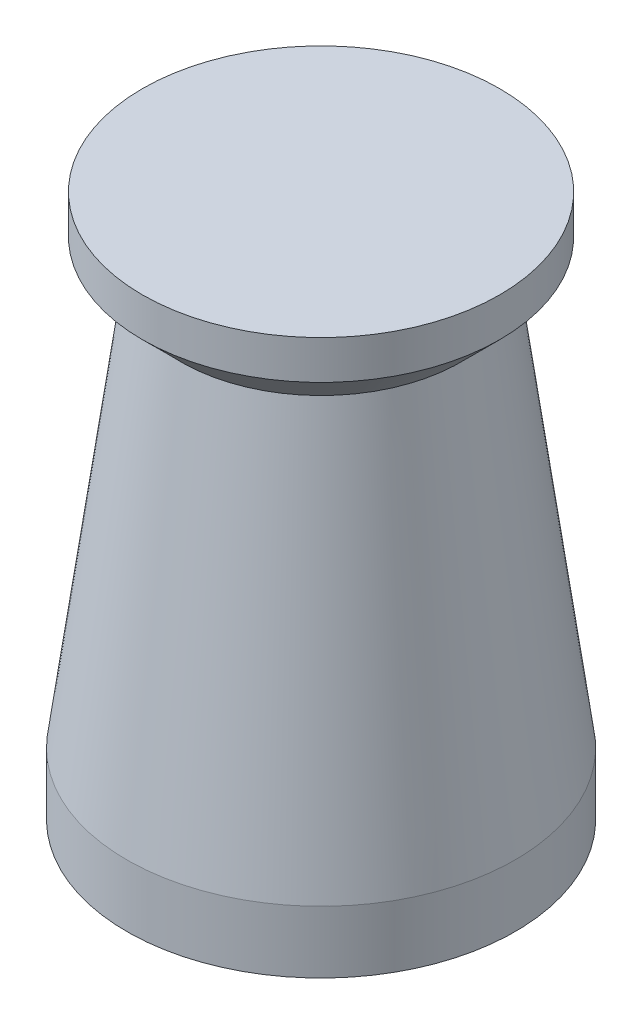
from build123d import *


with BuildPart() as part:
    # 草图1 → 旋转1 (revolve)
    with BuildSketch(Plane.XY, mode=Mode.PRIVATE) as revolve_1_sk:
        Polygon((0, 0), (25, 0), (25, 8), (18, 60), (23, 65), (23, 70), (0, 70), align=None)
    revolve(revolve_1_sk.sketch.rotate(Axis((0, 70, 0), (0, -1, 0)), 180), axis=Axis((0, 70, 0), (0, -1, 0)))


solid = part.part
